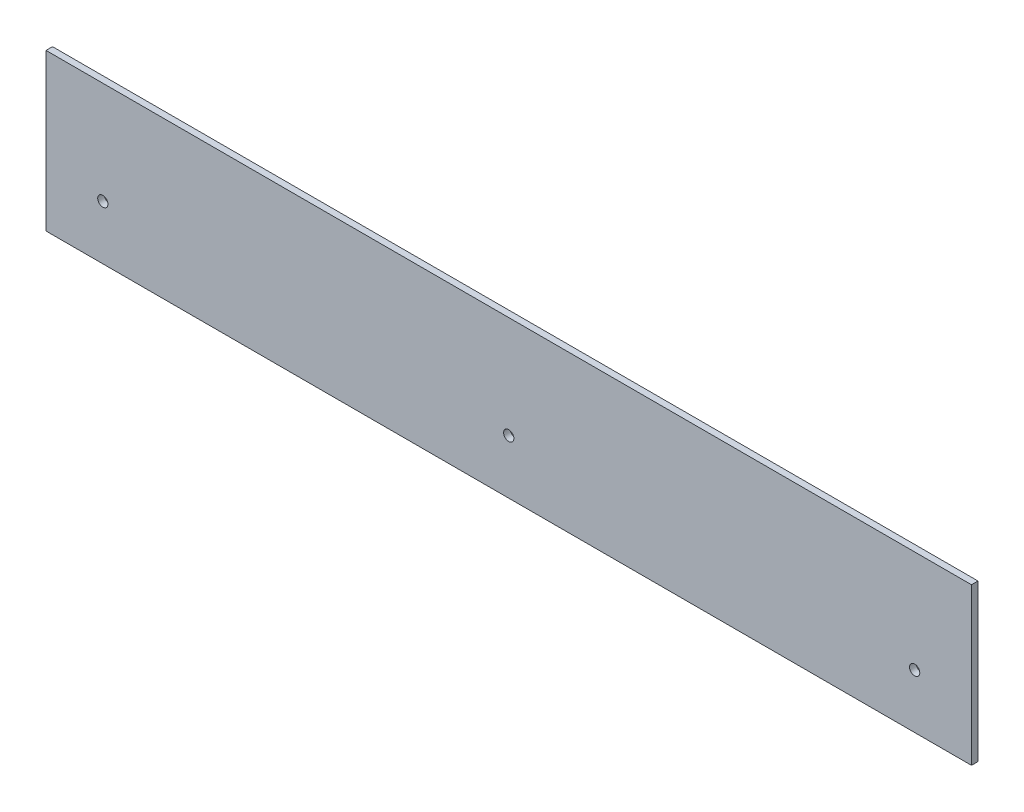
from build123d import *

# Parameters (mm, degrees)
SKETCH1_W           = 450.85
SKETCH1_H           = 76.2
BOSS_EXTRUDE1_DEPTH = 3.175
SKETCH2_R           = 2.5
CUT_EXTRUDE1_DEPTH  = 229.64409297


with BuildPart() as part:
    # Sketch1 → Boss-Extrude1 (new body)
    with BuildSketch(Plane.XY):
        Rectangle(SKETCH1_W, SKETCH1_H)
    extrude(amount=BOSS_EXTRUDE1_DEPTH)

    # Sketch2 → Cut-Extrude1 (cut, through all)
    with BuildSketch(Plane.XY.offset(3.175)):
        with Locations((-197.739, -11.684)):
            Circle(SKETCH2_R)
        with Locations(Location((197.739, -11.684, 0), (0, 0, 180))):
            Circle(SKETCH2_R)
        with Locations((0, -11.684)):
            Circle(SKETCH2_R)
    extrude(amount=-CUT_EXTRUDE1_DEPTH, mode=Mode.SUBTRACT)


solid = part.part
